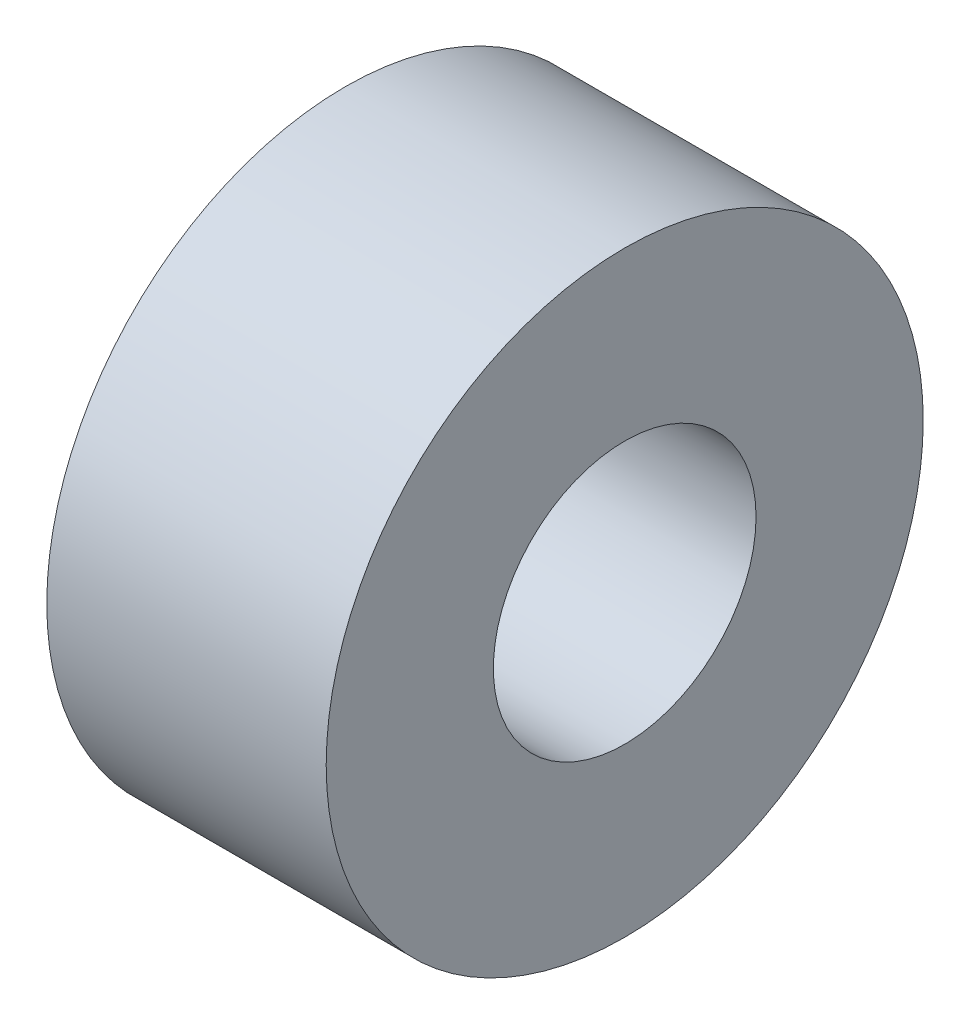
from build123d import *

# Parameters (mm, degrees)
SKETCH1_R           = 3.175
SKETCH1_R_2         = 1.397
BOSS_EXTRUDE1_DEPTH = 2.9718


with BuildPart() as part:
    # Sketch1 → Boss-Extrude1 (new body)
    with BuildSketch(Plane.YZ):
        with Locations(Location((0, 0, 0), (0, 0, 270))):
            Circle(SKETCH1_R)
        with Locations(Location((0, 0, 0), (0, 0, 270))):
            Circle(SKETCH1_R_2, mode=Mode.SUBTRACT)
    extrude(amount=BOSS_EXTRUDE1_DEPTH)


solid = part.part
